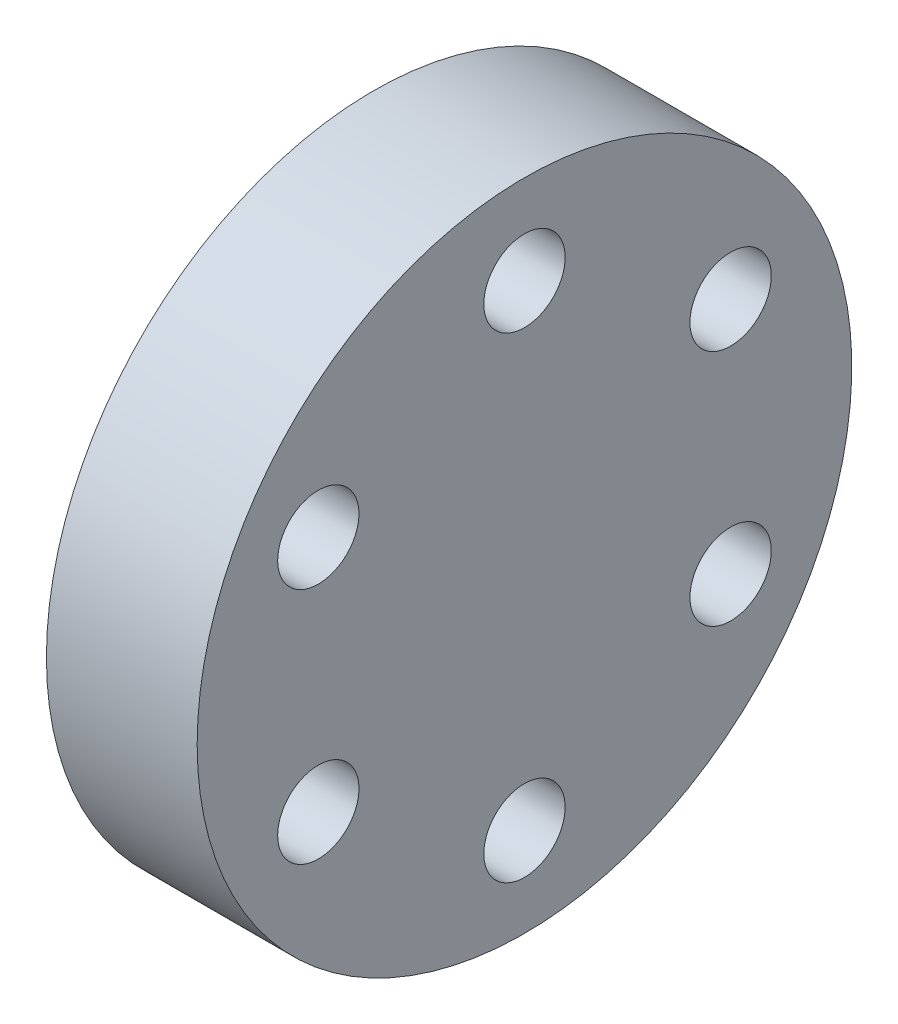
from build123d import *

# Parameters (mm, degrees)
SKETCH_1_R          = 16.5
SKETCH_1_R_2        = 2.05
EXTRUDE_1_DEPTH     = 7.6
SKETCH_2_R          = 3.225
CUT_EXTRUDE_1_DEPTH = 4


with BuildPart() as part:
    # 草图1 → 凸台-拉伸1 (new body)
    with BuildSketch(Plane(origin=(0, 0, 0), x_dir=(0, 0, -1), z_dir=(1, 0, 0))):
        with Locations(Location((0, 0, 0), (0, 0, 180))):
            Circle(SKETCH_1_R)
        with Locations(Location((0, 12, 0), (0, 0, 180))):
            Circle(SKETCH_1_R_2, mode=Mode.SUBTRACT)
        with Locations(Location((10.392304845, 6, 0), (0, 0, 180))):
            Circle(SKETCH_1_R_2, mode=Mode.SUBTRACT)
        with Locations(Location((10.392304845, -6, 0), (0, 0, 180))):
            Circle(SKETCH_1_R_2, mode=Mode.SUBTRACT)
        with Locations(Location((0, -12, 0), (0, 0, 180))):
            Circle(SKETCH_1_R_2, mode=Mode.SUBTRACT)
        with Locations(Location((-10.392304845, -6, 0), (0, 0, 180))):
            Circle(SKETCH_1_R_2, mode=Mode.SUBTRACT)
        with Locations(Location((-10.392304845, 6, 0), (0, 0, 180))):
            Circle(SKETCH_1_R_2, mode=Mode.SUBTRACT)
    extrude(amount=EXTRUDE_1_DEPTH)

    # 草图2 → 切除-拉伸1 (cut)
    with BuildSketch(Plane.ZY):
        Circle(SKETCH_2_R)
    extrude(amount=-CUT_EXTRUDE_1_DEPTH, mode=Mode.SUBTRACT)


solid = part.part
